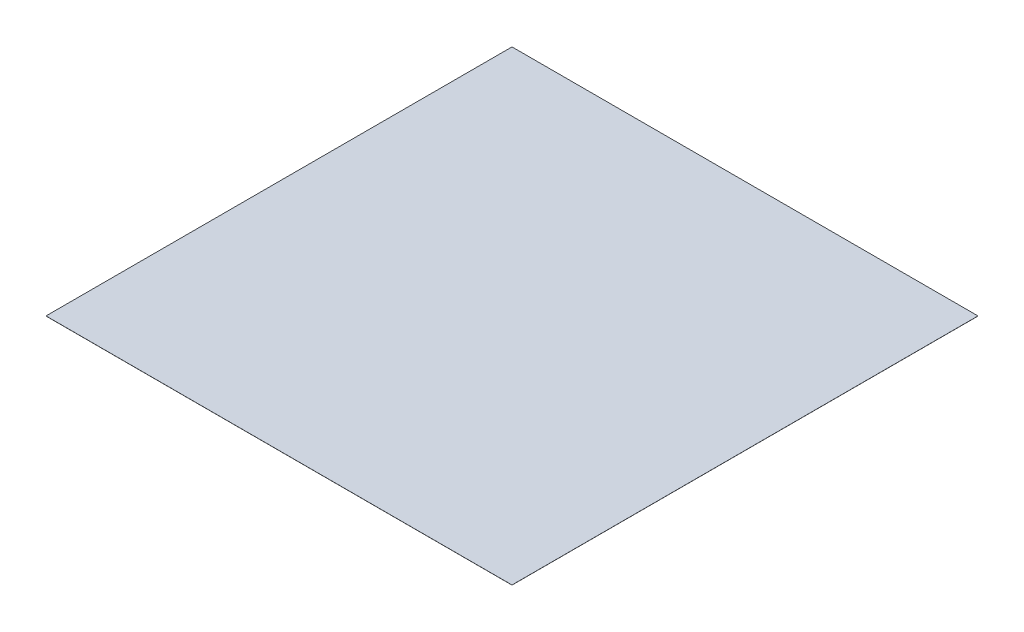
from build123d import *

# Parameters (mm, degrees)
SKETCH_1_W      = 800
SKETCH_1_H      = 800
EXTRUDE_1_DEPTH = 0.2


with BuildPart() as part:
    # 草图1 → 凸台-拉伸1 (new body)
    with BuildSketch(Plane(origin=(0, 0, 0), x_dir=(1, 0, 0), z_dir=(0, 1, 0))):
        Rectangle(SKETCH_1_W, SKETCH_1_H)
    extrude(amount=EXTRUDE_1_DEPTH)


solid = part.part
